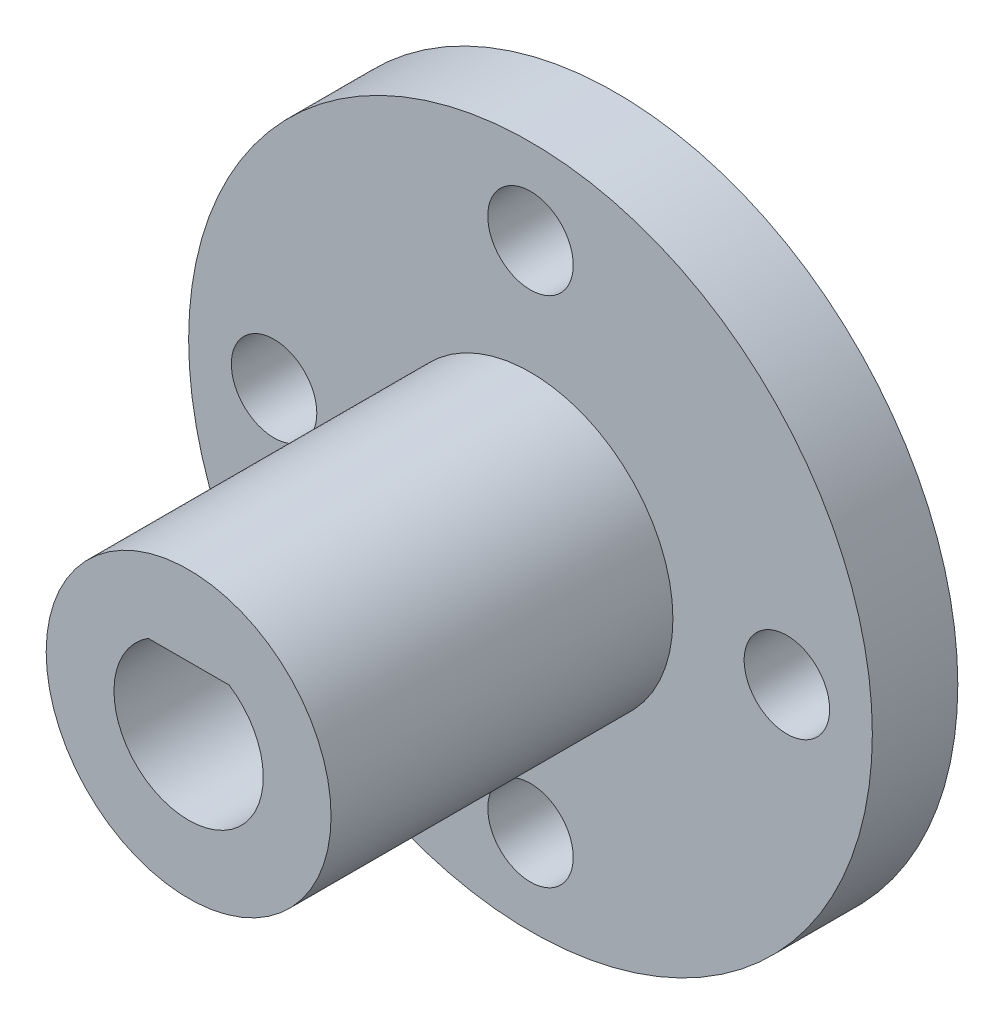
from build123d import *

# Parameters (mm, degrees)
SKETCH1_R           = 12
BOSS_EXTRUDE1_DEPTH = 3
SKETCH2_R           = 5
BOSS_EXTRUDE2_DEPTH = 15
CUT_EXTRUDE1_DEPTH  = 15
SKETCH4_R           = 1.5
CUT_EXTRUDE2_DEPTH  = 5


with BuildPart() as part:
    # Sketch1 → Boss-Extrude1 (new body)
    with BuildSketch(Plane.XY):
        Circle(SKETCH1_R)
    extrude(amount=BOSS_EXTRUDE1_DEPTH)

    # Sketch2 → Boss-Extrude2 (add)
    with BuildSketch(Plane.XY):
        Circle(SKETCH2_R)
    extrude(amount=BOSS_EXTRUDE2_DEPTH)

    # Sketch3 → Cut-Extrude1 (cut)
    with BuildSketch(Plane.XY):
        with BuildLine():
            Line((-0.065110368, 2.2008), (1.421576364, 2.2008))
            ThreePointArc((1.421576364, 2.2008), (0, -2.62), (-1.421576364, 2.2008))
            Line((-1.421576364, 2.2008), (-0.065110368, 2.2008))
        make_face()
    extrude(amount=CUT_EXTRUDE1_DEPTH, mode=Mode.SUBTRACT)

    # Sketch4 → Cut-Extrude2 (cut)
    with BuildSketch(Plane.XY):
        with Locations((-9, 0)):
            Circle(SKETCH4_R)
        with Locations((0, 9)):
            Circle(SKETCH4_R)
        with Locations((9, 0)):
            Circle(SKETCH4_R)
        with Locations((0, -9)):
            Circle(SKETCH4_R)
    extrude(amount=CUT_EXTRUDE2_DEPTH, mode=Mode.SUBTRACT)


solid = part.part
